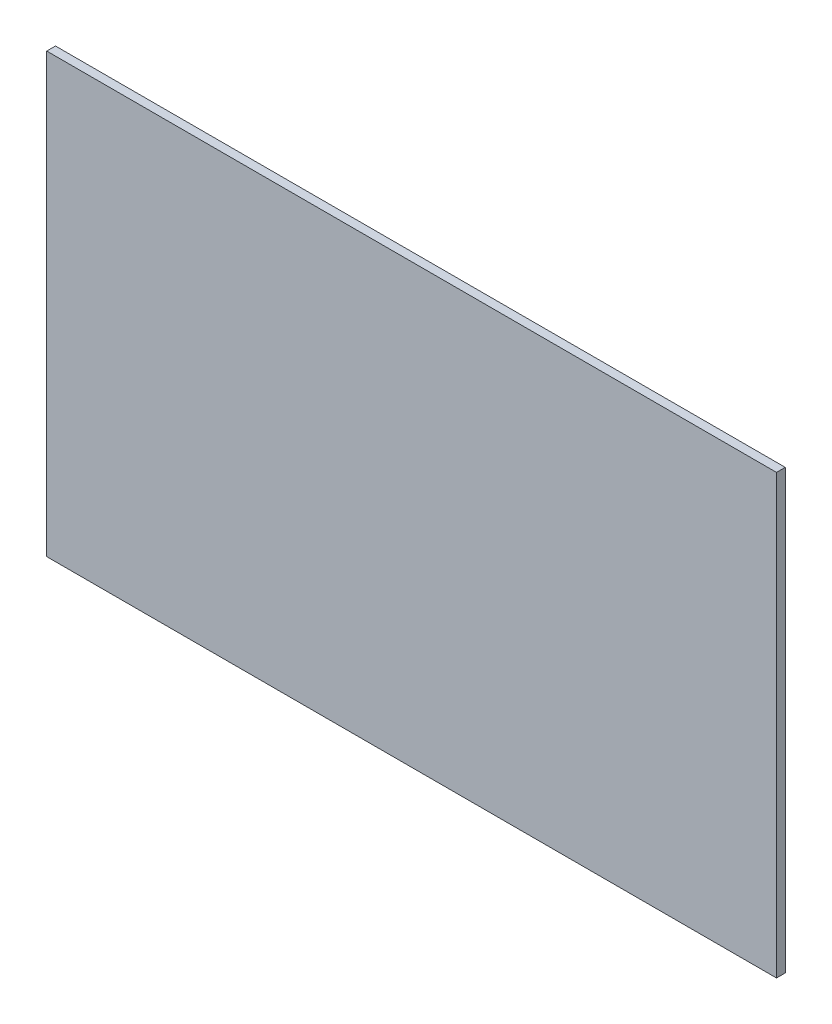
from build123d import *

# Parameters (mm, degrees)
SKETCH1_W           = 250
SKETCH1_H           = 150
BOSS_EXTRUDE1_DEPTH = 3


with BuildPart() as part:
    # Sketch1 → Boss-Extrude1 (new body)
    with BuildSketch(Plane.XY):
        with Locations((125, 75)):
            Rectangle(SKETCH1_W, SKETCH1_H)
    extrude(amount=BOSS_EXTRUDE1_DEPTH)


solid = part.part
